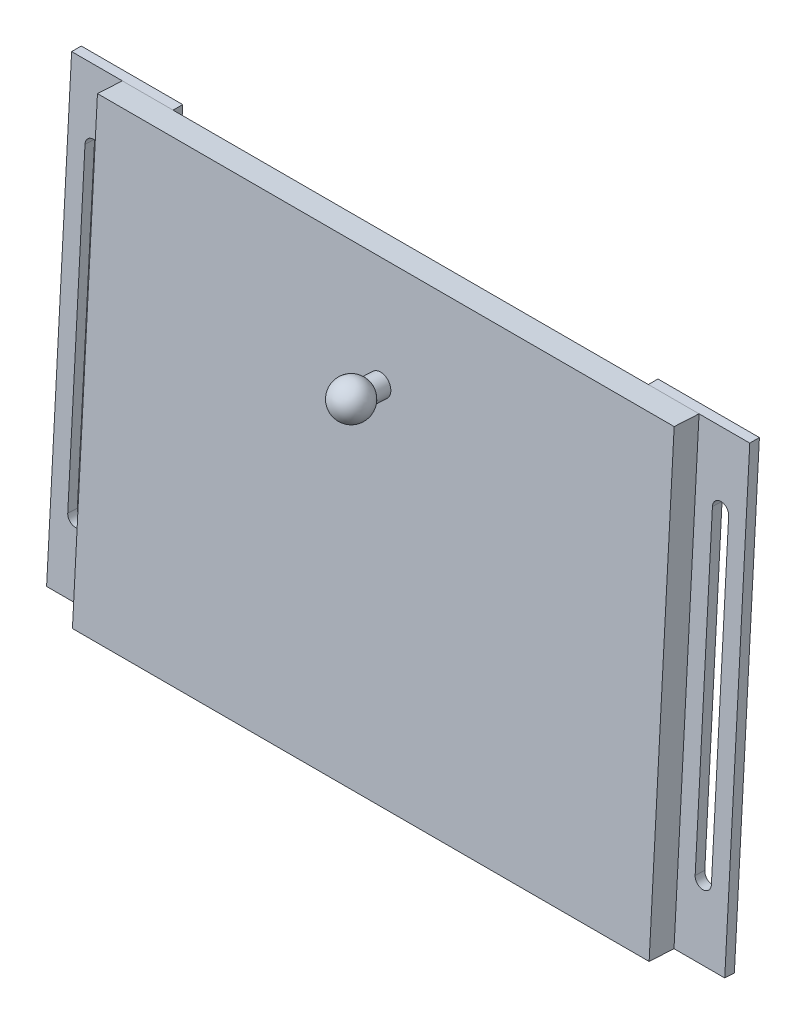
from build123d import *

# Parameters (mm, degrees)
BOSS_EXTRU_1_DEPTH      = 113.7
BOSS_EXTRU_2_DEPTH      = 10
ENL_V_MAT_EXTRU_1_DEPTH = 10
ESQUISSE7_R             = 2.135429921
BOSS_EXTRU_3_DEPTH      = 8


with BuildPart() as part:
    # Esquisse1 → Boss.-Extru.1 (new body)
    with BuildSketch(Plane(origin=(0, 0, 0), x_dir=(0, 0, -1), z_dir=(1, 0, 0))):
        Polygon((0.098261178, 46.06547401), (5.004980628, 45.792878485), (0.068148881, -43.07009295), (-4.838570569, -42.797497425), align=None)
    extrude(amount=BOSS_EXTRU_1_DEPTH)

    # Esquisse4 → Boss.-Extru.2 (add, symmetric)
    with BuildSketch(Plane.ZY):
        Polygon((-5.004980628, 45.792878485), (-6.904980628, 45.792878485), (-1.968148881, -43.175523419), (-0.068148881, -43.07009295), align=None)
    boss_extru_2 = extrude(amount=BOSS_EXTRU_2_DEPTH, both=True)

    # Esquisse5 → Enlèv. mat.-Extru.1 (cut)
    with BuildSketch(Plane(origin=(0, -0.241410847, -4.350550784), x_dir=(-1, 0, 0), z_dir=(0, -0.05540448773291252, -0.9984639917087915))):
        with BuildLine():
            Line((3.4, -29.138054447), (3.4, 32.243000428))
            ThreePointArc((3.4, 32.243000428), (5, 33.843000428), (6.6, 32.243000428))
            Line((6.6, 32.243000428), (6.6, -29.138054447))
            ThreePointArc((6.6, -29.138054447), (5, -30.738054447), (3.4, -29.138054447))
        make_face()
    enl_v_mat_extru_1 = extrude(amount=-ENL_V_MAT_EXTRU_1_DEPTH, mode=Mode.SUBTRACT)

    # Esquisse7 → Boss.-Extru.3 (add)
    with BuildSketch(Plane(origin=(0, 0.136297763, 2.453359725), x_dir=(1, 0, 0), z_dir=(0, 0.0554700196225224, 0.9984603532054125))):
        with Locations(Location((56.8495, 25.234545409, 0), (0, 0, 90))):
            Circle(ESQUISSE7_R)
    extrude(amount=BOSS_EXTRU_3_DEPTH)

    # Esquisse8 → Révolution4 (revolve)
    with BuildSketch(Plane(origin=(56.85, 0, 0), x_dir=(0, 0, -1), z_dir=(1, 0, 0))):
        with BuildLine():
            Line((-6.406620571, 29.309512271), (-7.063469335, 22.166281969))
            ThreePointArc((-7.063469335, 22.166281969), (-10.306660104, 26.066321502), (-6.406620571, 29.309512271))
        make_face()
    revolve(axis=Axis((56.85, 29.309512271, 6.406620571), (0, -0.9957988523704411, 0.09156771056279951)))

    # Symétrie1: Boss.-Extru.2, Enlèv. mat.-Extru.1 across plane
    add(boss_extru_2.mirror(Plane(origin=(56.85, 0, 0), x_dir=(0, 0, 1), z_dir=(1, 0, 0))))
    add(enl_v_mat_extru_1.mirror(Plane(origin=(56.85, 0, 0), x_dir=(0, 0, 1), z_dir=(1, 0, 0))), mode=Mode.SUBTRACT)


solid = part.part
